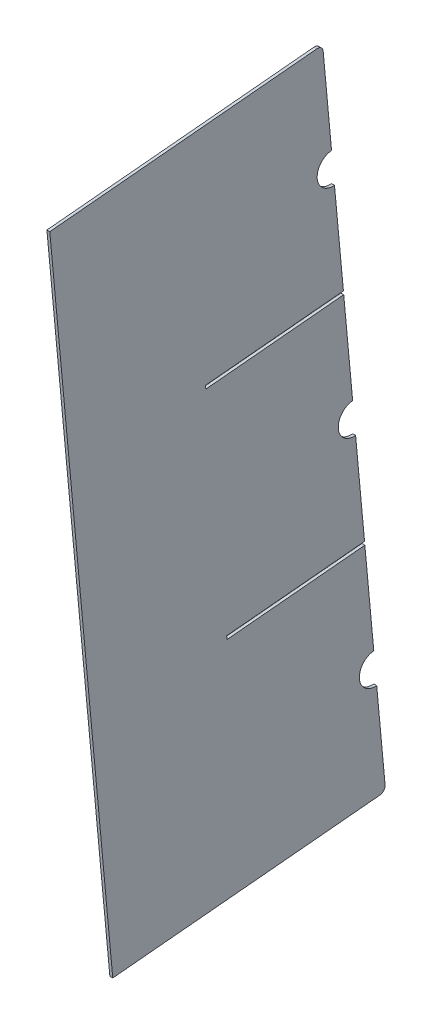
from build123d import *

# Parameters (mm, degrees)
EXTRUDE_1_DEPTH = 1


with BuildPart() as part:
    # 草图1 → 凸台-拉伸1 (new body)
    with BuildSketch(Plane(origin=(-61.5, 0, 0), x_dir=(0, -1, 0), z_dir=(-1, 0, 0))):
        with BuildLine():
            Line((145.112990447, 800.603209432), (176.378367534, 797.698696456))
            ThreePointArc((176.378367534, 797.698696456), (177.840703349, 798.15115608), (178.554793652, 799.505120921))
            Line((178.554793652, 799.505120921), (187.157332086, 892.106397006))
            Line((187.157332086, 892.106397006), (-47.830852387, 913.936494537))
            Line((-47.830852387, 913.936494537), (-56.433390821, 821.335218452))
            ThreePointArc((-56.433390821, 821.335218452), (-55.980931196, 819.872882636), (-54.626966355, 819.158792334))
            Line((-54.626966355, 819.158792334), (-23.361589268, 816.254279357))
            ThreePointArc((-23.361589268, 816.254279357), (-17.376417442, 821.221946637), (-12.408750162, 815.236774811))
            Line((-12.408750162, 815.236774811), (20.848052217, 812.147261008))
            Line((20.848052217, 812.147261008), (25.288072054, 859.941468019))
            Line((25.288072054, 859.941468019), (26.482927229, 859.830467523))
            Line((26.482927229, 859.830467523), (22.042907393, 812.036260512))
            Line((22.042907393, 812.036260512), (55.399281036, 808.937496668))
            ThreePointArc((55.399281036, 808.937496668), (61.384452862, 813.905163948), (66.352120143, 807.919992122))
            Line((66.352120143, 807.919992122), (99.708493786, 804.821228277))
            Line((99.708493786, 804.821228277), (104.148513623, 852.615435289))
            Line((104.148513623, 852.615435289), (105.343368798, 852.504434793))
            Line((105.343368798, 852.504434793), (100.903348961, 804.710227781))
            Line((100.903348961, 804.710227781), (134.16015134, 801.620713978))
            ThreePointArc((134.16015134, 801.620713978), (140.145323166, 806.588381259), (145.112990447, 800.603209432))
        make_face()
    extrude(amount=-EXTRUDE_1_DEPTH)


solid = part.part
